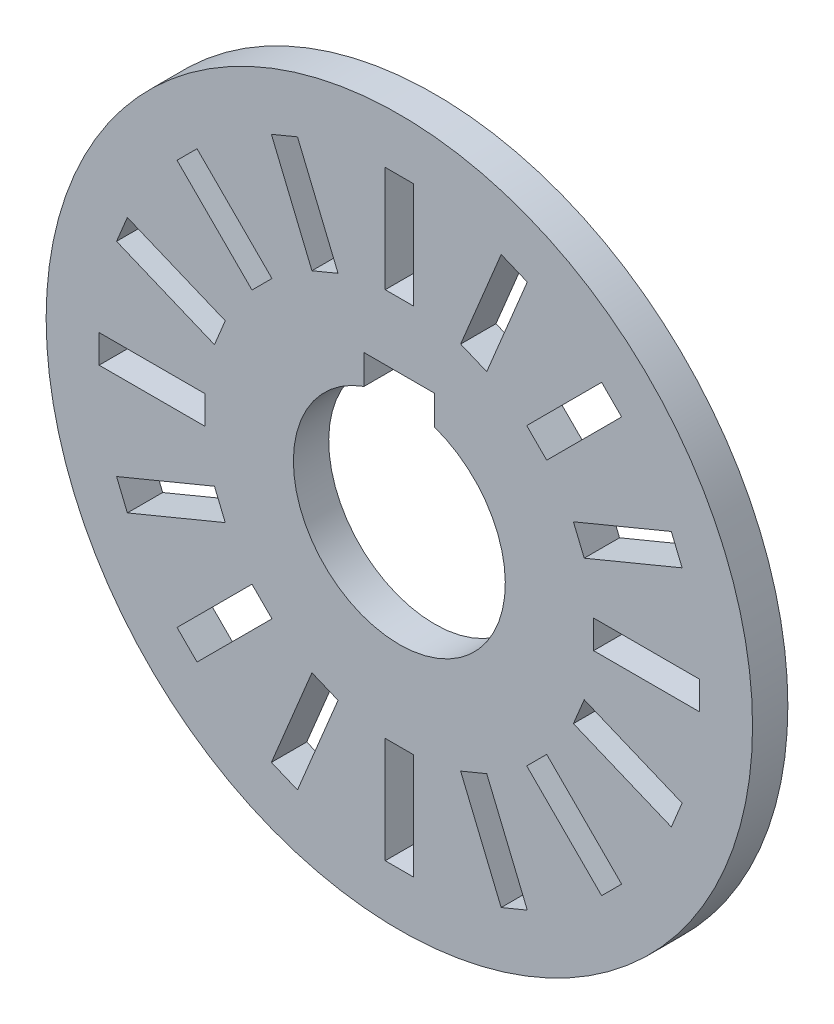
from build123d import *

# Parameters (mm, degrees)
SKETCH1_R           = 50
SKETCH1_W           = 15
SKETCH1_H           = 4
SKETCH1_W_2         = 4
SKETCH1_H_2         = 15
BOSS_EXTRUDE1_DEPTH = 5


with BuildPart() as part:
    # Sketch1 → Boss-Extrude1 (new body)
    with BuildSketch(Plane.XY):
        Circle(SKETCH1_R)
        with BuildLine():
            Line((-5, 14.142135624), (-5, 18.3))
            Line((-5, 18.3), (5, 18.3))
            Line((5, 18.3), (5, 14.142135624))
            ThreePointArc((5, 14.142135624), (0, -15), (-5, 14.142135624))
        make_face(mode=Mode.SUBTRACT)
        with Locations((-35, 0)):
            Rectangle(SKETCH1_W, SKETCH1_H, mode=Mode.SUBTRACT)
        Polygon((-38.499513267, 18.111804941), (-24.641320279, 12.371553455), (-26.172054009, 8.676035325), (-40.030246996, 14.41628681), align=None, mode=Mode.SUBTRACT)
        Polygon((-28.637824638, 31.466251763), (-18.03122292, 20.859650045), (-20.859650045, 18.03122292), (-31.466251763, 28.637824638), align=None, mode=Mode.SUBTRACT)
        Polygon((-14.41628681, 40.030246996), (-8.676035325, 26.172054009), (-12.371553455, 24.641320279), (-18.111804941, 38.499513267), align=None, mode=Mode.SUBTRACT)
        with Locations((0, 35)):
            Rectangle(SKETCH1_W_2, SKETCH1_H_2, mode=Mode.SUBTRACT)
        Polygon((18.111804941, 38.499513267), (12.371553455, 24.641320279), (8.676035325, 26.172054009), (14.41628681, 40.030246996), align=None, mode=Mode.SUBTRACT)
        Polygon((31.466251763, 28.637824638), (20.859650045, 18.03122292), (18.03122292, 20.859650045), (28.637824638, 31.466251763), align=None, mode=Mode.SUBTRACT)
        Polygon((40.030246996, 14.41628681), (26.172054009, 8.676035325), (24.641320279, 12.371553455), (38.499513267, 18.111804941), align=None, mode=Mode.SUBTRACT)
        with Locations((35, 0)):
            Rectangle(SKETCH1_W, SKETCH1_H, mode=Mode.SUBTRACT)
        Polygon((38.499513267, -18.111804941), (24.641320279, -12.371553455), (26.172054009, -8.676035325), (40.030246996, -14.41628681), align=None, mode=Mode.SUBTRACT)
        Polygon((28.637824638, -31.466251763), (18.03122292, -20.859650045), (20.859650045, -18.03122292), (31.466251763, -28.637824638), align=None, mode=Mode.SUBTRACT)
        Polygon((14.41628681, -40.030246996), (8.676035325, -26.172054009), (12.371553455, -24.641320279), (18.111804941, -38.499513267), align=None, mode=Mode.SUBTRACT)
        with Locations((0, -35)):
            Rectangle(SKETCH1_W_2, SKETCH1_H_2, mode=Mode.SUBTRACT)
        Polygon((-18.111804941, -38.499513267), (-12.371553455, -24.641320279), (-8.676035325, -26.172054009), (-14.41628681, -40.030246996), align=None, mode=Mode.SUBTRACT)
        Polygon((-31.466251763, -28.637824638), (-20.859650045, -18.03122292), (-18.03122292, -20.859650045), (-28.637824638, -31.466251763), align=None, mode=Mode.SUBTRACT)
        Polygon((-40.030246996, -14.41628681), (-26.172054009, -8.676035325), (-24.641320279, -12.371553455), (-38.499513267, -18.111804941), align=None, mode=Mode.SUBTRACT)
    extrude(amount=BOSS_EXTRUDE1_DEPTH)


solid = part.part
